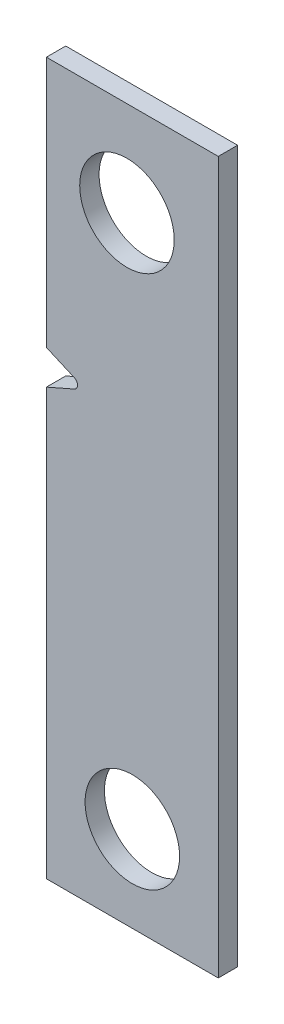
from build123d import *

# Parameters (mm, degrees)
SKETCH1_W           = 42.5
SKETCH1_H           = 40
BOSS_EXTRUDE1_DEPTH = 2.25
SKETCH3_R           = 11
CUT_EXTRUDE2_DEPTH  = 5
SKETCH4_W           = 42.5
SKETCH4_H           = 4.5
BOSS_EXTRUDE2_DEPTH = 15
SKETCH8_W           = 2.5
SKETCH8_H           = 55
CUT_EXTRUDE4_DEPTH  = 10
SKETCH9_W           = 40
SKETCH9_H           = 4.5
BOSS_EXTRUDE3_DEPTH = 110.599864081
SKETCH11_R          = 11
CUT_EXTRUDE5_DEPTH  = 100
CUT_EXTRUDE6_DEPTH  = 100


with BuildPart() as part:
    # Sketch1 → Boss-Extrude1 (new, symmetric)
    with BuildSketch(Plane.XY):
        Rectangle(SKETCH1_W, SKETCH1_H)
    extrude(amount=BOSS_EXTRUDE1_DEPTH, both=True)

    # Sketch3 → Cut-Extrude2 (cut, symmetric)
    with BuildSketch(Plane.XY.offset(2.25)):
        with Locations((1.25, 0)):
            Circle(SKETCH3_R)
    extrude(amount=CUT_EXTRUDE2_DEPTH, both=True, mode=Mode.SUBTRACT)

    # Sketch4 → Boss-Extrude2 (add)
    with BuildSketch(Plane(origin=(0, 20, 0), x_dir=(1, 0, 0), z_dir=(0, 1, 0))):
        Rectangle(SKETCH4_W, SKETCH4_H)
    extrude(amount=BOSS_EXTRUDE2_DEPTH)

    # Sketch8 → Cut-Extrude4 (cut)
    with BuildSketch(Plane.XY.offset(2.25)):
        with Locations((-20, 7.5)):
            Rectangle(SKETCH8_W, SKETCH8_H)
    extrude(amount=-CUT_EXTRUDE4_DEPTH, mode=Mode.SUBTRACT)

    # Sketch9 → Boss-Extrude3 (add)
    with BuildSketch(Plane(origin=(0, 35, 0), x_dir=(1, 0, 0), z_dir=(0, 1, 0))):
        with Locations((1.25, 0)):
            Rectangle(SKETCH9_W, SKETCH9_H)
    extrude(amount=BOSS_EXTRUDE3_DEPTH)

    # Sketch11 → Cut-Extrude5 (cut)
    with BuildSketch(Plane(origin=(0, 0, -2.25), x_dir=(-1, 0, 0), z_dir=(0, 0, -1))):
        with Locations((0, 123.599864081)):
            Circle(SKETCH11_R)
    extrude(amount=-CUT_EXTRUDE5_DEPTH, mode=Mode.SUBTRACT)

    # Sketch12 → Cut-Extrude6 (cut)
    with BuildSketch(Plane(origin=(0, 0, -2.25), x_dir=(-1, 0, 0), z_dir=(0, 0, -1))):
        with BuildLine():
            Line((18.75, 79.099864081), (18.75, 87.099864081))
            Line((18.75, 87.099864081), (12.247409908, 84.244374107))
            ThreePointArc((12.247409908, 84.244374107), (11.5, 83.099864066), (12.247409936, 81.955354043))
            Line((12.247409936, 81.955354043), (18.75, 79.099864081))
        make_face()
    extrude(amount=-CUT_EXTRUDE6_DEPTH, mode=Mode.SUBTRACT)


solid = part.part
